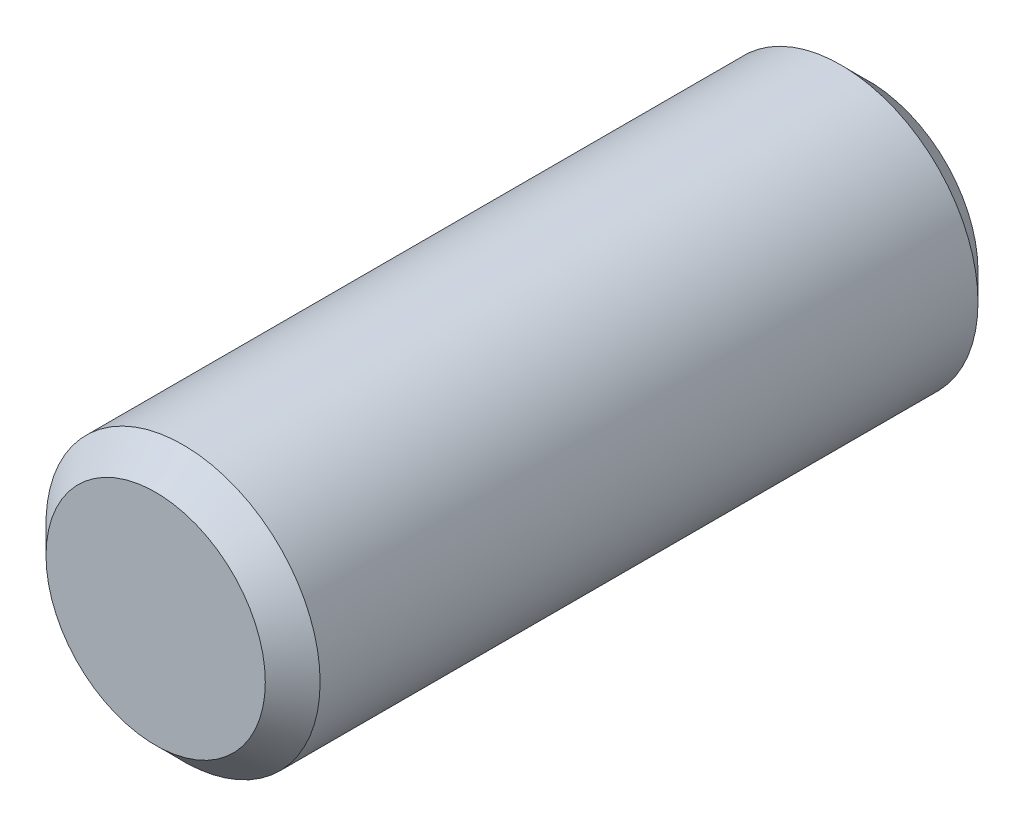
from build123d import *

# Parameters (mm, degrees)
SKETCH1_R           = 10
BOSS_EXTRUDE1_DEPTH = 52
CHAMFER2_SIZE       = 2


with BuildPart() as part:
    # Sketch1 → Boss-Extrude1 (new body)
    with BuildSketch(Plane.XY):
        Circle(SKETCH1_R)
    extrude(amount=-BOSS_EXTRUDE1_DEPTH)

    # Chamfer2
    chamfer2_edges = [part.edges().sort_by_distance(p)[0] for p in [
        (-10, 0, 0),
        (-10, 0, -52),
    ]]
    chamfer(chamfer2_edges, length=CHAMFER2_SIZE)


solid = part.part
